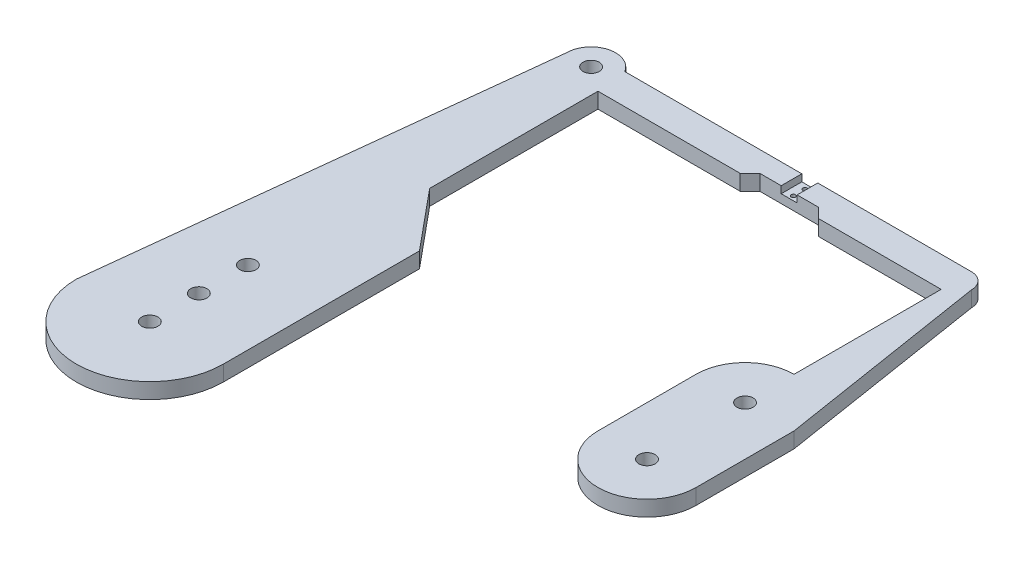
from build123d import *

# Parameters (mm, degrees)
SKETCH1_R           = 3.3
SKETCH1_R_2         = 0.889
BOSS_EXTRUDE1_DEPTH = 6.35
SKETCH3_W           = 6.5
SKETCH3_H           = 10.724019234
CUT_EXTRUDE2_DEPTH  = 2.85


with BuildPart() as part:
    # Sketch1 → Boss-Extrude1 (new body)
    with BuildSketch(Plane(origin=(0, 0, 0), x_dir=(1, 0, 0), z_dir=(0, 1, 0))):
        with BuildLine():
            Line((10, -7.2), (10, -75.857864376))
            Line((10, -75.857864376), (30, -100))
            Line((30, -100), (30, -180))
            ThreePointArc((30, -180), (0, -210), (-30, -180))
            Line((-30, -180), (-10, 0))
            ThreePointArc((-10, 0), (-2.709235972, 9.626008542), (8.532008089, 5.215825723))
            Line((8.532008089, 5.215825723), (75, 5.215825723))
            Line((75, 5.215825723), (150, 5.215825723))
            ThreePointArc((150, 5.215825723), (154.485699703, 3.357788069), (156.343737357, -1.127911635))
            Line((156.343737357, -1.127911635), (170, -87.2))
            Line((170, -87.2), (170, -127.2))
            ThreePointArc((170, -127.2), (150, -147.2), (130, -127.2))
            Line((130, -127.2), (130, -87.2))
            ThreePointArc((130, -87.2), (135.857864376, -73.057864376), (150, -67.2))
            Line((150, -67.2), (150, -7.2))
            Line((150, -7.2), (100, -7.2))
            Line((100, -7.2), (96, -3.2))
            Line((96, -3.2), (84, -3.2))
            Line((84, -3.2), (72, -3.2))
            Line((72, -3.2), (68, -7.2))
            Line((68, -7.2), (59, -7.2))
            Line((59, -7.2), (10, -7.2))
        make_face()
        with Locations(Location((0, 0, 0), (0, 0, 270))):
            Circle(SKETCH1_R, mode=Mode.SUBTRACT)
        with Locations(Location((0, -180, 0), (0, 0, 270))):
            Circle(SKETCH1_R, mode=Mode.SUBTRACT)
        with Locations(Location((150, -87.2, 0), (0, 0, 270))):
            Circle(SKETCH1_R, mode=Mode.SUBTRACT)
        with Locations(Location((84, -1.5, 0), (0, 0, 270))):
            Circle(SKETCH1_R_2, mode=Mode.SUBTRACT)
        with Locations(Location((84, 3.216, 0), (0, 0, 270))):
            Circle(SKETCH1_R_2, mode=Mode.SUBTRACT)
        with Locations(Location((150, -127.2, 0), (0, 0, 270))):
            Circle(SKETCH1_R, mode=Mode.SUBTRACT)
        with Locations(Location((0, -160, 0), (0, 0, 270))):
            Circle(SKETCH1_R, mode=Mode.SUBTRACT)
        with Locations(Location((0, -140, 0), (0, 0, 270))):
            Circle(SKETCH1_R, mode=Mode.SUBTRACT)
    extrude(amount=BOSS_EXTRUDE1_DEPTH)

    # Sketch3 → Cut-Extrude2 (cut)
    with BuildSketch(Plane(origin=(0, 6.35, 0), x_dir=(1, 0, 0), z_dir=(0, 1, 0))):
        with Locations((84, 0.476239432)):
            Rectangle(SKETCH3_W, SKETCH3_H)
    extrude(amount=-CUT_EXTRUDE2_DEPTH, mode=Mode.SUBTRACT)


solid = part.part
